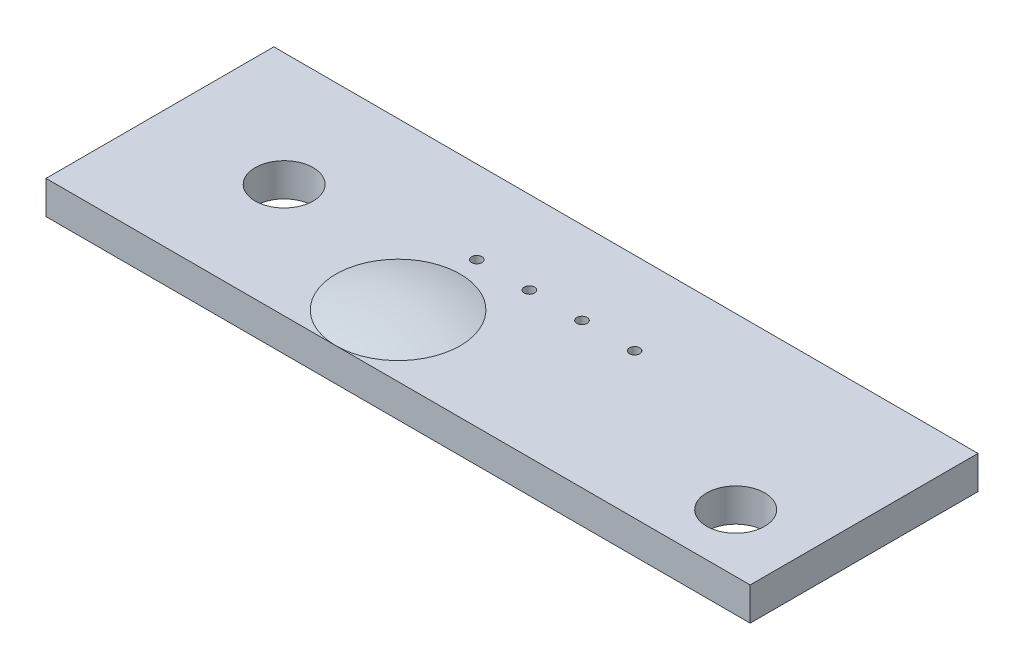
from build123d import *

# Parameters (mm, degrees)
SKETCH_1_W          = 34
SKETCH_1_H          = 11
EXTRUDE_1_DEPTH     = 1.6
SKETCH_2_R          = 1.4
CUT_EXTRUDE_2_DEPTH = 6.6
SKETCH_4_R          = 0.25
CUT_EXTRUDE_3_DEPTH = 10


with BuildPart() as part:
    # 草图1 → 拉伸1 (new body)
    with BuildSketch(Plane(origin=(0, 0, 0), x_dir=(1, 0, 0), z_dir=(0, 1, 0))):
        Rectangle(SKETCH_1_W, SKETCH_1_H)
    extrude(amount=EXTRUDE_1_DEPTH)

    # 草图2 → 切除-拉伸2 (cut)
    with BuildSketch(Plane(origin=(0, 0, 0), x_dir=(1, 0, 0), z_dir=(0, 1, 0))):
        with Locations(Location((-11, 0, 0), (0, 0, 270))):
            Circle(SKETCH_2_R)
        with Locations(Location((13.5, -2.7, 0), (0, 0, 270))):
            Circle(SKETCH_2_R)
    extrude(amount=CUT_EXTRUDE_2_DEPTH, mode=Mode.SUBTRACT)

    # 草图3 → 旋转1 (revolve)
    with BuildSketch(Plane.XY.offset(2.5)):
        with BuildLine():
            Line((0, 1.6), (-3, 1.6))
            Line((-3, 1.6), (-3, 2.060607986))
            ThreePointArc((-3, 2.060607986), (-1.482423007, 1.944785244), (0, 1.6))
        make_face()
    revolve(axis=Axis((-3, 10.072937712, 2.5), (0, -1, 0)))

    # 草图4 → 切除-拉伸3 (cut)
    with BuildSketch(Plane(origin=(0, 1.6, 0), x_dir=(-1, 0, 0), z_dir=(0, 1, 0))):
        with Locations(Location((3.2, -1.5, 0), (0, 0, 90))):
            Circle(SKETCH_4_R)
        with Locations(Location((0.66, -1.5, 0), (0, 0, 90))):
            Circle(SKETCH_4_R)
        with Locations(Location((-1.88, -1.5, 0), (0, 0, 90))):
            Circle(SKETCH_4_R)
        with Locations(Location((-4.42, -1.5, 0), (0, 0, 90))):
            Circle(SKETCH_4_R)
    extrude(amount=-CUT_EXTRUDE_3_DEPTH, mode=Mode.SUBTRACT)


solid = part.part
